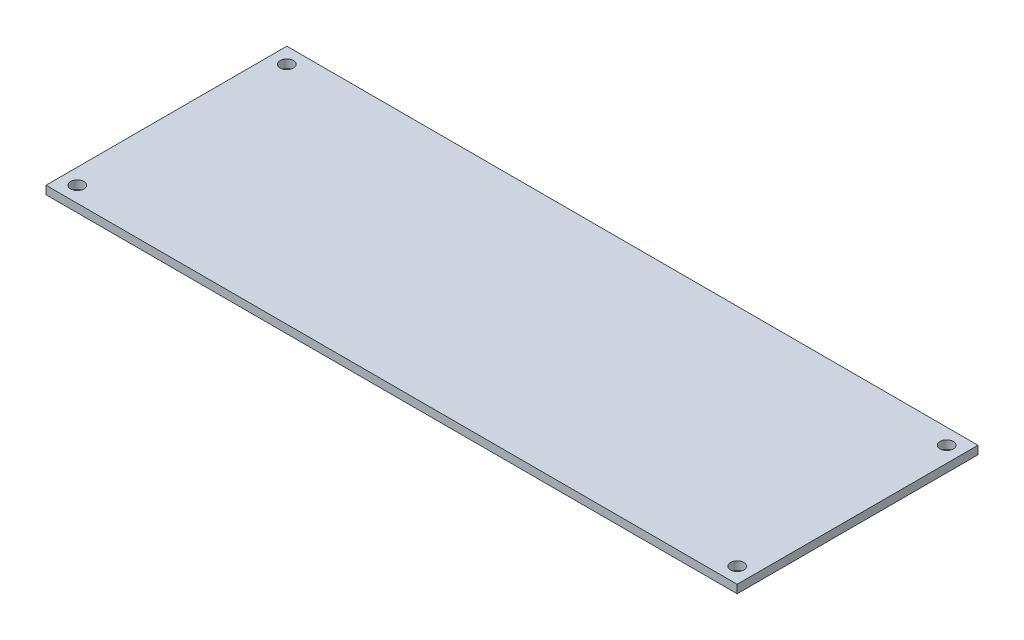
from build123d import *

# Parameters (mm, degrees)
SKETCH1_W           = 167.6
SKETCH1_H           = 58.4
BOSS_EXTRUDE1_DEPTH = 2
SKETCH2_R           = 1.6
CUT_EXTRUDE1_DEPTH  = 89.764181965


with BuildPart() as part:
    # Sketch1 → Boss-Extrude1 (new body)
    with BuildSketch(Plane(origin=(0, 0, 0), x_dir=(1, 0, 0), z_dir=(0, 1, 0))):
        Rectangle(SKETCH1_W, SKETCH1_H)
    extrude(amount=BOSS_EXTRUDE1_DEPTH)

    # Sketch2 → Cut-Extrude1 (cut, through all)
    with BuildSketch(Plane(origin=(0, 0, 0), x_dir=(1, 0, 0), z_dir=(0, 1, 0))):
        with Locations(Location((-80, 25.4, 0), (0, 0, 270))):
            Circle(SKETCH2_R)
        with Locations(Location((-80, -25.4, 0), (0, 0, 270))):
            Circle(SKETCH2_R)
        with Locations(Location((80, 25.4, 0), (0, 0, 270))):
            Circle(SKETCH2_R)
        with Locations(Location((80, -25.4, 0), (0, 0, 270))):
            Circle(SKETCH2_R)
    extrude(amount=CUT_EXTRUDE1_DEPTH, mode=Mode.SUBTRACT)


solid = part.part
